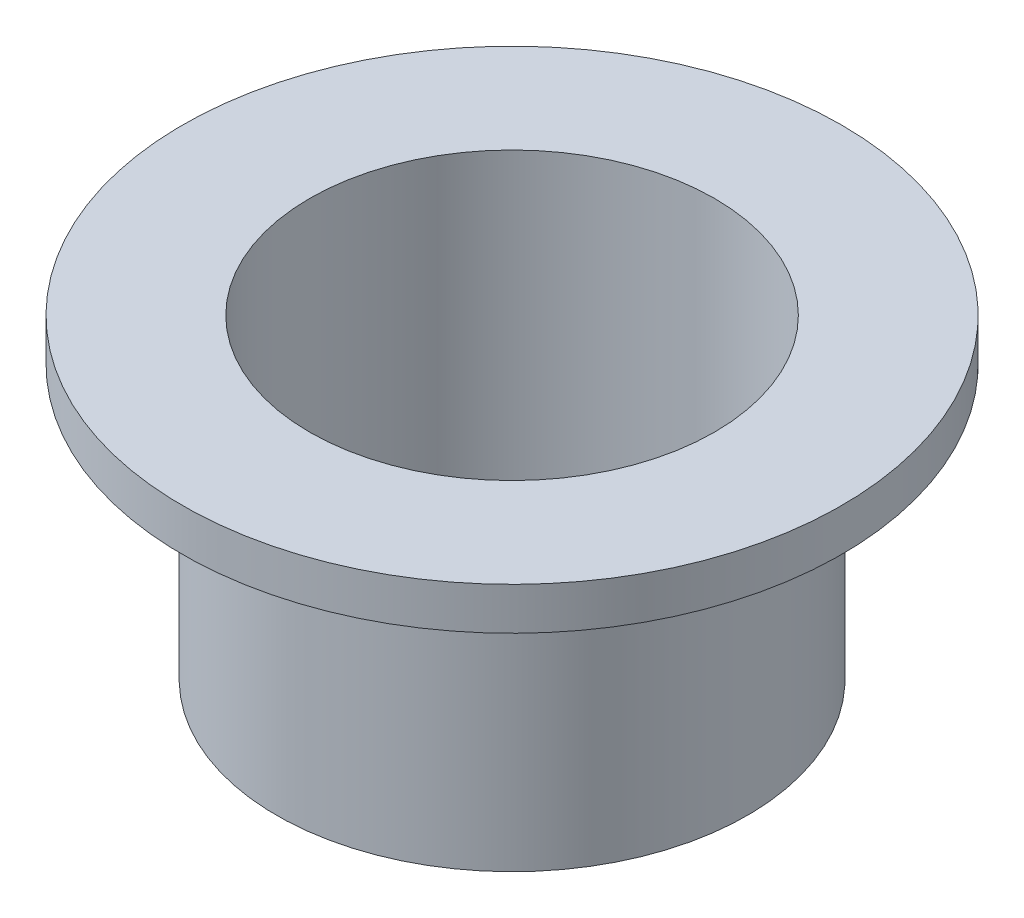
from build123d import *


with BuildPart() as part:
    # Sketch1 → Revolve1 (revolve)
    with BuildSketch(Plane(origin=(0, 0, 0), x_dir=(0, 1, 0), z_dir=(0, 0, 1)), mode=Mode.PRIVATE) as revolve1_sk:
        Polygon((-58, 50), (0, 50), (0, 70), (9, 70), (9, 43), (-58, 43), align=None)
    revolve(revolve1_sk.sketch.rotate(Axis((0, -147.995737503, 0), (0, 1, 0)), 270), axis=Axis((0, -147.995737503, 0), (0, 1, 0)))


solid = part.part
